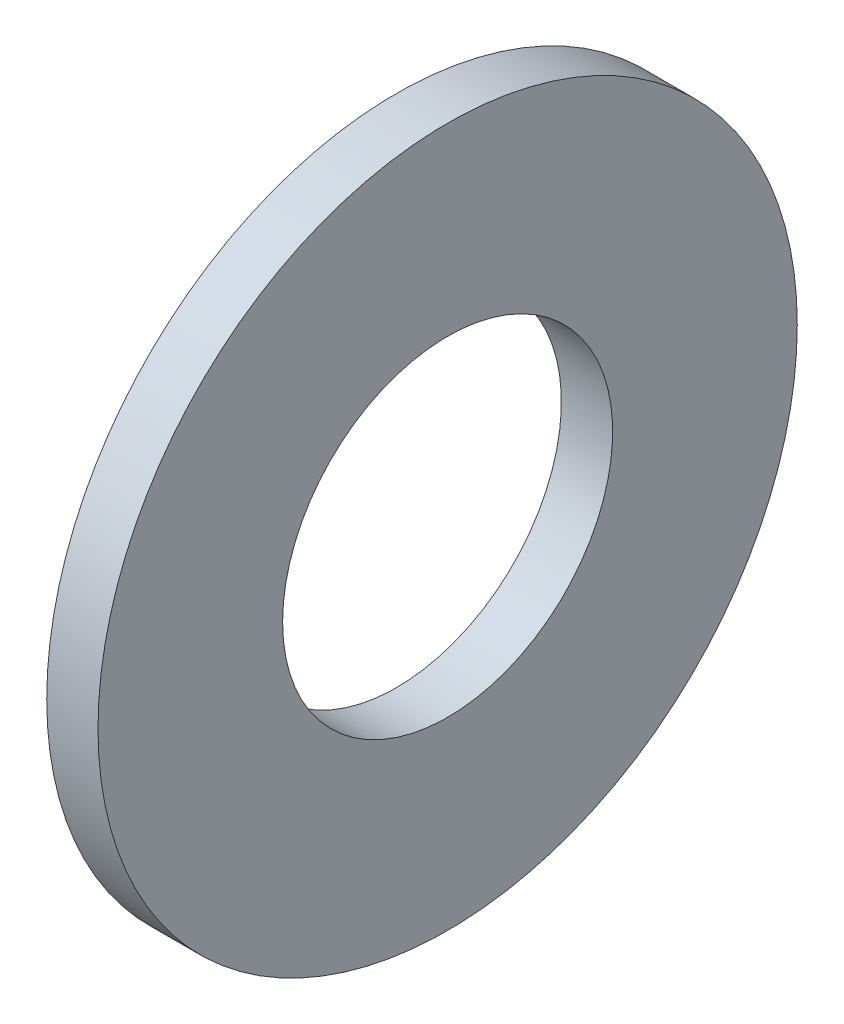
from build123d import *

# Parameters (mm, degrees)
SKETCH1_W = 4.191
SKETCH1_H = 15.0876


with BuildPart() as part:
    # Sketch1 → Base-Revolve (revolve)
    with BuildSketch(Plane.XY, mode=Mode.PRIVATE) as base_revolve_sk:
        with Locations((-2.0955, 21.0312)):
            Rectangle(SKETCH1_W, SKETCH1_H)
    revolve(base_revolve_sk.sketch.rotate(Axis((-34.925, 0, 0), (1, 0, 0)), 90), axis=Axis((-34.925, 0, 0), (1, 0, 0)))


solid = part.part
